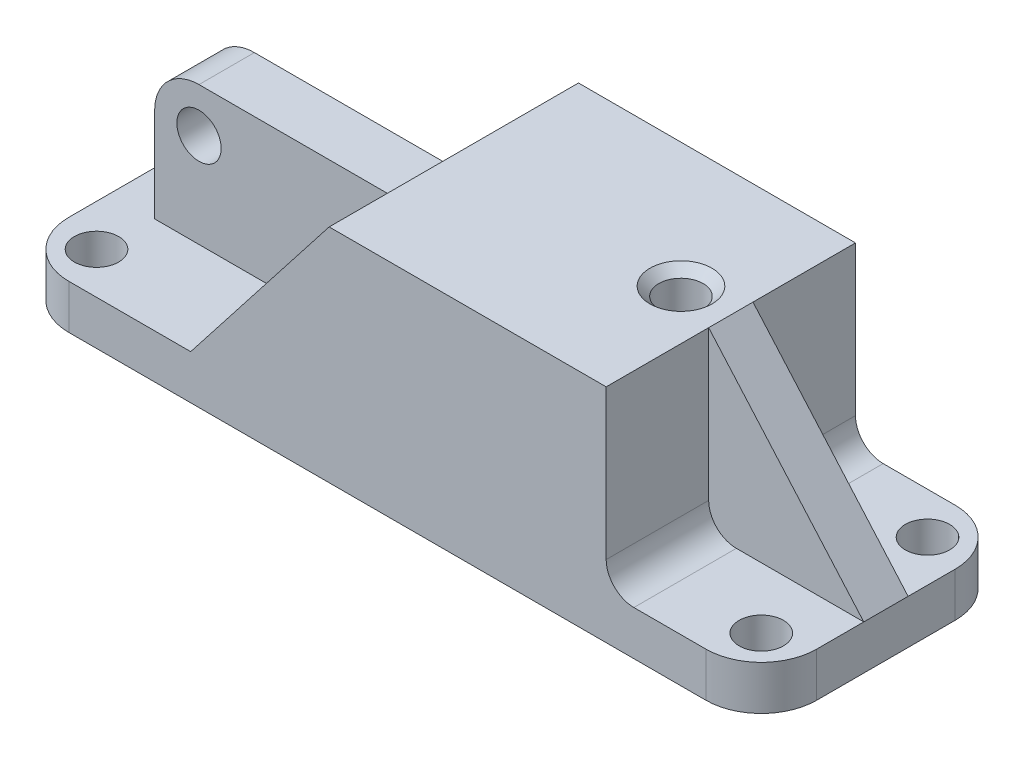
from build123d import *

# Parameters (mm, degrees)
EXTRUDE_1_DEPTH          = 22.5
EXTRUDE_2_DEPTH          = 5
EXTRUDE_3_DEPTH          = 4
CUT_EXTRUDE_1_DEPTH      = 23
CUT_EXTRUDE_1_DEPTH_BACK = 8
SKETCH_2_4_R             = 4
CUT_EXTRUDE_2_DEPTH      = 17.5
FILLET_1_R               = 5
SKETCH_4_R               = 4
CUT_EXTRUDE_4_DEPTH      = 35
SKETCH_5_R               = 4
CUT_EXTRUDE_5_DEPTH      = 47
FILLET_2_R               = 10
FILLET_3_R               = 1
CHAMFER_1_SIZE           = 1.6


with BuildPart() as part:
    # Эскиз1 → Бобышка-Вытянуть1 (new, symmetric)
    with BuildSketch(Plane.XY):
        Polygon((0, 0), (135, 0), (135, 8), (107, 8), (107, 40), (57, 40), (32, 8), (0, 8), align=None)
    extrude(amount=EXTRUDE_1_DEPTH, both=True)

    # Эскиз2 → Бобышка-Вытянуть2 (add, symmetric)
    with BuildSketch(Plane.XY):
        with BuildLine():
            Line((8, 8), (8, 25))
            ThreePointArc((8, 25), (10.343145751, 30.656854249), (16, 33))
            Line((16, 33), (51.53125, 33))
            Line((51.53125, 33), (32, 8))
            Line((32, 8), (8, 8))
        make_face()
    extrude(amount=EXTRUDE_2_DEPTH, both=True)

    # Эскиз2<3> → Бобышка-Вытянуть3 (add, symmetric)
    with BuildSketch(Plane.XY):
        Polygon((107, 40), (135, 8), (107, 8), align=None)
    extrude(amount=EXTRUDE_3_DEPTH, both=True)

    # Эскиз2<4> → Вырез-Вытянуть1 (cut, two sides: drawn at the far end of the back side and taken through both)
    with BuildSketch(Plane.XY.offset(-CUT_EXTRUDE_1_DEPTH_BACK)):
        with Locations((16, 25)):
            Circle(SKETCH_2_4_R)
    extrude(amount=CUT_EXTRUDE_1_DEPTH + CUT_EXTRUDE_1_DEPTH_BACK, mode=Mode.SUBTRACT)

    # Эскиз3 → Вырез-Вытянуть2 (cut, symmetric)
    with BuildSketch(Plane.XY):
        Polygon((35.901970252, 0), (59.339470252, 30), (91, 30), (91, 0), align=None)
    extrude(amount=CUT_EXTRUDE_2_DEPTH, both=True, mode=Mode.SUBTRACT)

    # Скругление1
    fillet_1_edges = [part.edges().sort_by_distance(p)[0] for p in [
        (107, 8, 13.25),
        (107, 8, -13.25),
    ]]
    fillet(fillet_1_edges, radius=FILLET_1_R)

    # Эскиз4 → Вырез-Вытянуть4 (cut)
    with BuildSketch(Plane.XZ):
        with Locations((7.5, 15)):
            Circle(SKETCH_4_R)
        with Locations((7.5, -15)):
            Circle(SKETCH_4_R)
        with Locations((127.5, -15)):
            Circle(SKETCH_4_R)
        with Locations((127.5, 15)):
            Circle(SKETCH_4_R)
    extrude(amount=-CUT_EXTRUDE_4_DEPTH, mode=Mode.SUBTRACT)

    # Эскиз5 → Вырез-Вытянуть5 (cut)
    with BuildSketch(Plane(origin=(0, 40, 0), x_dir=(1, 0, 0), z_dir=(0, 1, 0))):
        with Locations((98, 0)):
            Circle(SKETCH_5_R)
    extrude(amount=-CUT_EXTRUDE_5_DEPTH, mode=Mode.SUBTRACT)

    # Скругление2
    fillet_2_edges = [part.edges().sort_by_distance(p)[0] for p in [
        (135, 4, -22.5),
        (135, 4, 22.5),
        (0, 4, -22.5),
        (0, 4, 22.5),
    ]]
    fillet(fillet_2_edges, radius=FILLET_2_R)

    # Скругление3
    fillet_3_edges = [part.edges().sort_by_distance(p)[0] for p in [
        (41.765625, 20.5, -5),
        (41.765625, 20.5, 5),
        (91, 15, 17.5),
        (47.620720252, 15, 17.5),
        (75.169735126, 30, 17.5),
        (59.339470252, 30, 0),
        (91, 30, 0),
        (91, 15, -17.5),
        (47.620720252, 15, -17.5),
        (75.169735126, 30, -17.5),
    ]]
    fillet(fillet_3_edges, radius=FILLET_3_R)

    # Фаска1
    chamfer_1_edges = [part.edges().sort_by_distance(p)[0] for p in [
        (94, 40, 0),
    ]]
    chamfer(chamfer_1_edges, length=CHAMFER_1_SIZE)


solid = part.part
